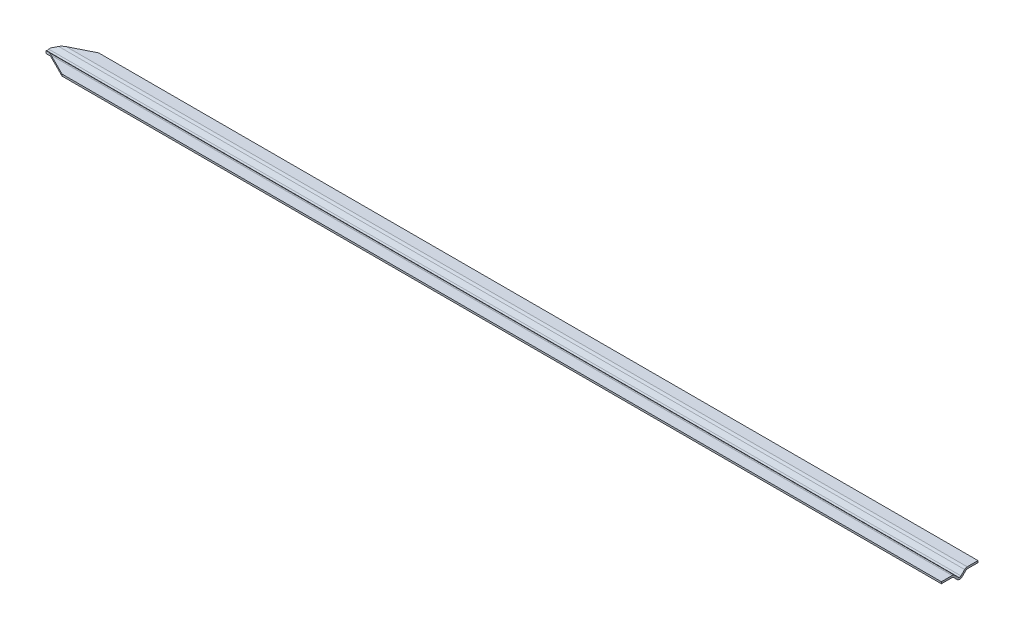
from build123d import *

# Parameters (mm, degrees)
SHEET_EXTRUDE_1_1_BACK   = 500
SHEET_EXTRUDE_1_1_DEPTH  = 1000
THICKEN_1_T1             = 1
THICKEN_1_T2             = 1
FILLET_1_R               = 2
FILLET_2_R               = 4
CUT_EXTRUDE_1_DEPTH      = 501.445463467
CUT_EXTRUDE_1_DEPTH_BACK = 501.445463467


with BuildPart() as body_1:
    # Sheet Extrude 1: a surface, the sketch's curves swept straight by 1000 mm
    with BuildLine(Plane(origin=(0, 0, 0), x_dir=(0, 0, -1), z_dir=(1, 0, 0)).offset(-SHEET_EXTRUDE_1_1_BACK), mode=Mode.PRIVATE) as sheet_extrude_1_1_path:
        Line((-20, 0), (-7, 0))
        Line((-7, 0), (0, -7))
        Line((0, -7), (7, 0))
        Line((7, 0), (20, 0))
    sheet_extrude_1_1 = Shell.extrude(sheet_extrude_1_1_path.wire(), (1 * SHEET_EXTRUDE_1_1_DEPTH, 0 * SHEET_EXTRUDE_1_1_DEPTH, 0 * SHEET_EXTRUDE_1_1_DEPTH))
    add(Solid.thicken(sheet_extrude_1_1, THICKEN_1_T1))
    add(Solid.thicken(sheet_extrude_1_1, -THICKEN_1_T2))

    # Скругление1
    fillet_1_edges = [body_1.edges().sort_by_distance(p)[0] for p in [
        (0, -5.585786438, 0),
        (0, -1, -7.414213562),
        (0, -1, 7.414213562),
    ]]
    fillet(fillet_1_edges, radius=FILLET_1_R)

    # Скругление2
    fillet_2_edges = [body_1.edges().sort_by_distance(p)[0] for p in [
        (0, 1, 6.585786438),
        (0, 1, -6.585786438),
        (0, -8.414213562, 0),
    ]]
    fillet(fillet_2_edges, radius=FILLET_2_R)

    # Эскиз2 → Вырез-Вытянуть1 (cut, two sides: drawn at the far end of the back side and taken through both)
    with BuildSketch(Plane(origin=(0, 0, 0), x_dir=(1, 0, 0), z_dir=(0, 1, 0)).offset(-CUT_EXTRUDE_1_DEPTH_BACK)):
        with BuildLine():
            Line((1267.734544165, -883.867272083), (-460, -20))
            Line((-460, -20), (-494.633436854, -2.683281573))
            ThreePointArc((-494.633436854, -2.683281573), (-496.291796068, 0), (-494.633436854, 2.683281573))
            Line((-494.633436854, 2.683281573), (-460, 20))
            Line((-460, 20), (1267.734544165, 883.867272083))
            Line((1267.734544165, 883.867272083), (-2595.597343663, 883.867272083))
            Line((-2595.597343663, 883.867272083), (-2595.597343663, -883.867272083))
            Line((-2595.597343663, -883.867272083), (1267.734544165, -883.867272083))
        make_face()
    extrude(amount=CUT_EXTRUDE_1_DEPTH + CUT_EXTRUDE_1_DEPTH_BACK, mode=Mode.SUBTRACT)


solid = body_1.part
